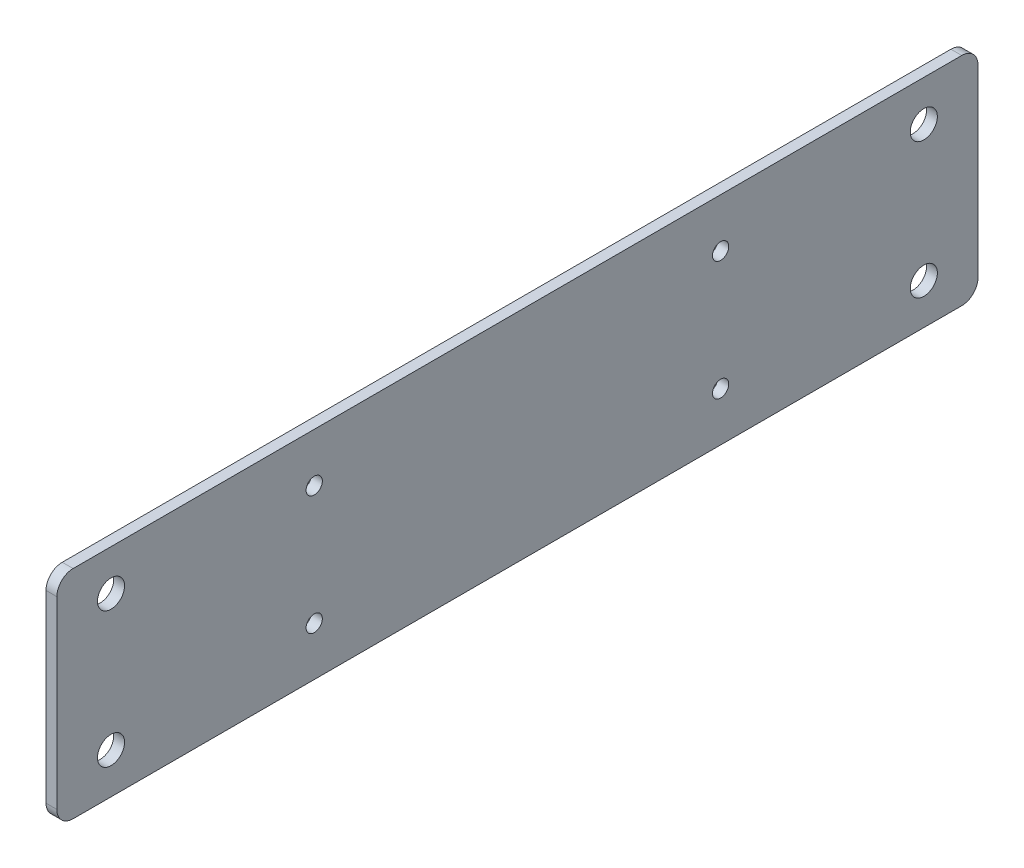
from build123d import *

# Parameters (mm, degrees)
SKETCH_1_W          = 170
SKETCH_1_H          = 40
EXTRUDE_1_DEPTH     = 2
SKETCH_2_R          = 2.5
CUT_EXTRUDE_1_DEPTH = 88.344146913
SKETCH_3_R          = 1.5
CUT_EXTRUDE_2_DEPTH = 88.344146913
FILLET_1_R          = 3


with BuildPart() as part:
    # 草图1 → 凸台-拉伸1 (new body)
    with BuildSketch(Plane(origin=(0, 0, 0), x_dir=(0, 0, -1), z_dir=(1, 0, 0))):
        Rectangle(SKETCH_1_W, SKETCH_1_H)
    extrude(amount=EXTRUDE_1_DEPTH)

    # 草图2 → 切除-拉伸1 (cut, through all)
    with BuildSketch(Plane(origin=(2, 0, 0), x_dir=(0, 0, -1), z_dir=(1, 0, 0))):
        with Locations((-75, 12.5)):
            Circle(SKETCH_2_R)
        with Locations(Location((-75, -12.5, 0), (0, 0, 180))):
            Circle(SKETCH_2_R)
        with Locations((75, -12.5)):
            Circle(SKETCH_2_R)
        with Locations(Location((75, 12.5, 0), (0, 0, 180))):
            Circle(SKETCH_2_R)
    extrude(amount=-CUT_EXTRUDE_1_DEPTH, mode=Mode.SUBTRACT)

    # 草图3 → 切除-拉伸2 (cut, through all)
    with BuildSketch(Plane(origin=(2, 0, 0), x_dir=(0, 0, -1), z_dir=(1, 0, 0))):
        with Locations((-37.5, 11)):
            Circle(SKETCH_3_R)
        with Locations((-37.5, -11)):
            Circle(SKETCH_3_R)
        with Locations((37.5, 11)):
            Circle(SKETCH_3_R)
        with Locations((37.5, -11)):
            Circle(SKETCH_3_R)
    extrude(amount=-CUT_EXTRUDE_2_DEPTH, mode=Mode.SUBTRACT)

    # 圆角1
    fillet_1_edges = [part.edges().sort_by_distance(p)[0] for p in [
        (1, -20, -85),
        (1, -20, 85),
        (1, 20, 85),
        (1, 20, -85),
    ]]
    fillet(fillet_1_edges, radius=FILLET_1_R)


solid = part.part
